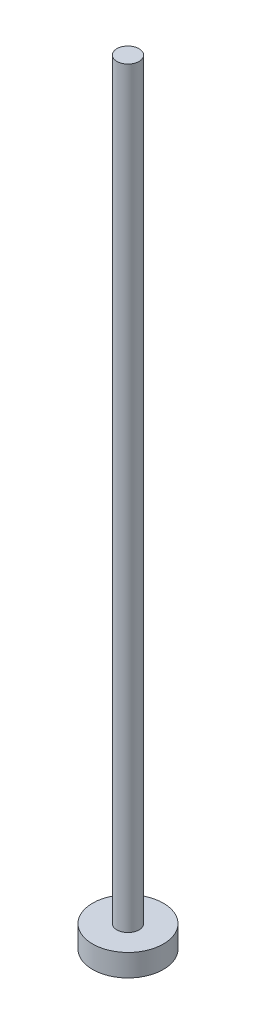
from build123d import *


with BuildPart() as part:
    # Szkic1 → Obrót1 (revolve)
    with BuildSketch(Plane.XY, mode=Mode.PRIVATE) as obr_t1_sk:
        Polygon((0, 175), (0, 0), (8, 0), (8, 5), (2.5, 5), (2.5, 175), align=None)
    revolve(obr_t1_sk.sketch.rotate(Axis((0, 175, 0), (0, -1, 0)), 180), axis=Axis((0, 175, 0), (0, -1, 0)))


solid = part.part
